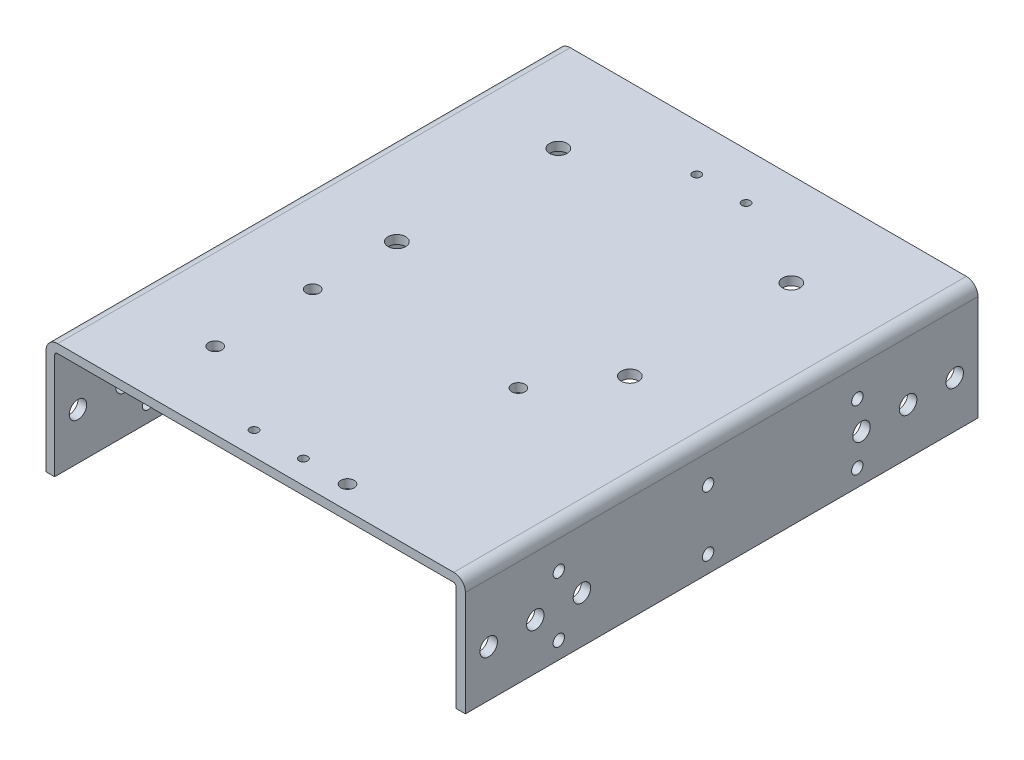
from build123d import *

# Parameters (mm, degrees)
SKETCH1_W                      = 114.3
SKETCH1_H                      = 139.7
BOSS_EXTRUDE1_DEPTH            = 31.836483884
SKETCH2_W                      = 109.4232
SKETCH2_H                      = 29.474283884
CUT_EXTRUDE1_DEPTH             = 203.397374705
M4_CLEARANCE_HOLE1_D           = 4.7625
M4_CLEARANCE_HOLE1_DEPTH       = 31.836483884
M3_CLEARANCE_HOLE1_D           = 3.59918
M2_CLEARANCE_HOLE1_D           = 2.286
M2_CLEARANCE_HOLE1_DEPTH       = 31.836483884
M4_CLEARANCE_HOLE2_D           = 4.7625
F_3_1_3_1_DIAMETER_HOLE1_D     = 3.1
M4_CLEARANCE_HOLE3_D           = 4.7625
M4_CLEARANCE_HOLE3_DEPTH       = 2.3622
F_3_1_3_1_DIAMETER_HOLE2_D     = 3.1
F_3_1_3_1_DIAMETER_HOLE2_DEPTH = 2.3622
FILLET1_R                      = 0.7366
FILLET2_R                      = 3.175


with BuildPart() as part:
    # Sketch1 → Boss-Extrude1 (new body)
    with BuildSketch(Plane.XZ.offset(31.836483884)):
        with Locations((85.8012, -50.8)):
            Rectangle(SKETCH1_W, SKETCH1_H)
    extrude(amount=-BOSS_EXTRUDE1_DEPTH)

    # Sketch2 → Cut-Extrude1 (cut, through all)
    with BuildSketch(Plane(origin=(0, 0, -120.65), x_dir=(-1, 0, 0), z_dir=(0, 0, -1))):
        with Locations((-85.725, -17.099341942)):
            Rectangle(SKETCH2_W, SKETCH2_H)
    extrude(amount=-CUT_EXTRUDE1_DEPTH, mode=Mode.SUBTRACT)

    # M4 Clearance Hole1
    with Locations(Plane(origin=(0, 0, 0), x_dir=(1, 0, 0), z_dir=(0, 1, 0))):
        with Locations((117.475, 95.25), (53.975, 51.246745007), (117.475, 51.246745007), (53.975, 95.25)):
            Hole(M4_CLEARANCE_HOLE1_D / 2, depth=M4_CLEARANCE_HOLE1_DEPTH)

    # M3 Clearance Hole1 (through all)
    with Locations(Plane(origin=(0, 0, 0), x_dir=(1, 0, 0), z_dir=(0, 1, 0))):
        with Locations((104.4702, -12.7), (53.74894, 28.51658), (105.08488, 33.24352), (53.91894, 1.777120394)):
            Hole(M3_CLEARANCE_HOLE1_D / 2)

    # M2 Clearance Hole1
    with Locations(Plane(origin=(0, 0, 0), x_dir=(1, 0, 0), z_dir=(0, 1, 0))):
        with Locations((92.456, 107.95), (78.994, 107.95), (78.994, -12.7), (92.456, -12.7)):
            Hole(M2_CLEARANCE_HOLE1_D / 2, depth=M2_CLEARANCE_HOLE1_DEPTH)

    # M4 Clearance Hole2 (through all)
    with Locations(Plane(origin=(142.9512, 0, 0), x_dir=(0, 0, -1), z_dir=(1, 0, 0))):
        with Locations((12.7, -19.136483884), (-12.7, -19.136483884), (0, -19.136483884), (88.9, -19.136483884), (101.6, -19.136483884), (114.3, -19.136483884)):
            Hole(M4_CLEARANCE_HOLE2_D / 2)

    # Ø3.1 (3.1) Diameter Hole1 (through all)
    with Locations(Plane(origin=(142.9512, 0, 0), x_dir=(0, 0, -1), z_dir=(1, 0, 0))):
        with Locations((47.09318, -27.181483884), (87.75, -27.181483884), (47.09318, -10.881483884), (87.77636, -10.881483884), (6.41, -10.881483884), (6.41, -27.181483884)):
            Hole(F_3_1_3_1_DIAMETER_HOLE1_D / 2)

    # M4 Clearance Hole3
    with Locations(Plane(origin=(31.0134, 0, 0), x_dir=(0, 0, -1), z_dir=(1, 0, 0))):
        with Locations((12.7, -19.136483884), (-12.7, -19.136483884), (0, -19.136483884)):
            Hole(M4_CLEARANCE_HOLE3_D / 2, depth=M4_CLEARANCE_HOLE3_DEPTH)

    # Ø3.1 (3.1) Diameter Hole2
    with Locations(Plane(origin=(31.0134, 0, 0), x_dir=(0, 0, -1), z_dir=(1, 0, 0))):
        with Locations((47.05, -27.181483884), (87.75, -27.181483884), (47.05, -10.881483884), (87.75, -10.881483884)):
            Hole(F_3_1_3_1_DIAMETER_HOLE2_D / 2, depth=F_3_1_3_1_DIAMETER_HOLE2_DEPTH)

    # Fillet1
    fillet1_edges = [part.edges().sort_by_distance(p)[0] for p in [
        (140.4366, -2.3622, -50.8),
        (31.0134, -2.3622, -50.8),
    ]]
    fillet(fillet1_edges, radius=FILLET1_R)

    # Fillet2
    fillet2_edges = [part.edges().sort_by_distance(p)[0] for p in [
        (28.6512, 0, -50.8),
        (142.9512, 0, -50.8),
    ]]
    fillet(fillet2_edges, radius=FILLET2_R)


solid = part.part
